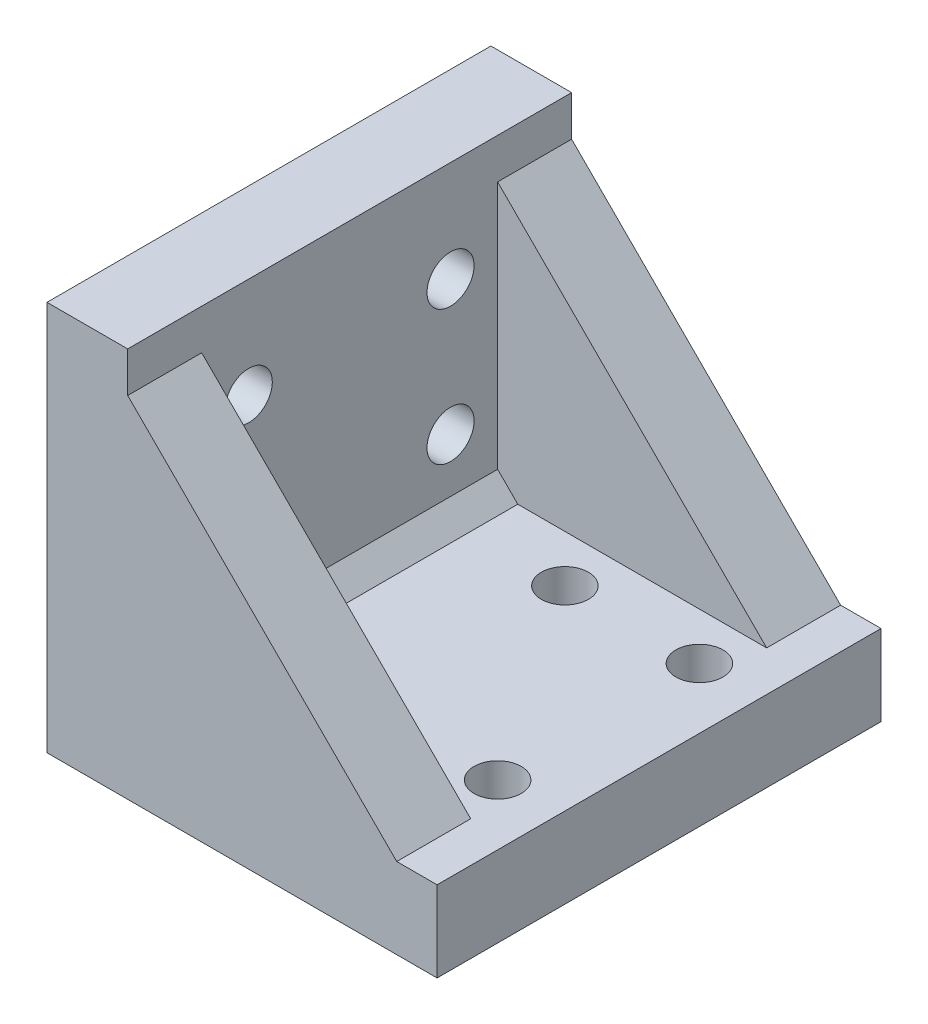
from build123d import *

# Parameters (mm, degrees)
BOSS_EXTRUDE1_DEPTH = 16.5
CUT_EXTRUDE1_REACH  = 42.525
SKETCH2_R           = 1.75
CUT_EXTRUDE2_REACH  = 42.525
SKETCH6_R           = 1.75
BOSS_EXTRUDE2_DEPTH = 5.5
CHAMFER1_SIZE       = 1.5


with BuildPart() as part:
    # Sketch1 → Boss-Extrude1 (new, symmetric)
    with BuildSketch(Plane.XY):
        Polygon((0, 0), (0, 29), (6, 29), (6, 6), (29, 6), (29, 0), align=None)
    extrude(amount=BOSS_EXTRUDE1_DEPTH, both=True)

    # Sketch2 → Cut-Extrude1 (cut, up to next)
    with BuildSketch(Plane(origin=(6, 0, 0), x_dir=(0, 0, -1), z_dir=(1, 0, 0)), mode=Mode.PRIVATE) as cut_extrude1_sk1:
        with Locations(Location((7.5, 21.5, 0), (0, 0, 90))):
            Circle(SKETCH2_R)
    cut_extrude1_tool1 = extrude(cut_extrude1_sk1.sketch, amount=-CUT_EXTRUDE1_REACH, mode=Mode.PRIVATE) & part.part
    # Sketch2 → Cut-Extrude1 (cut, up to next)
    with BuildSketch(Plane(origin=(6, 0, 0), x_dir=(0, 0, -1), z_dir=(1, 0, 0)), mode=Mode.PRIVATE) as cut_extrude1_sk2:
        with Locations(Location((7.5, 11.5, 0), (0, 0, 90))):
            Circle(SKETCH2_R)
    cut_extrude1_tool2 = extrude(cut_extrude1_sk2.sketch, amount=-CUT_EXTRUDE1_REACH, mode=Mode.PRIVATE) & part.part
    # Sketch2 → Cut-Extrude1 (cut, up to next)
    with BuildSketch(Plane(origin=(6, 0, 0), x_dir=(0, 0, -1), z_dir=(1, 0, 0)), mode=Mode.PRIVATE) as cut_extrude1_sk3:
        with Locations(Location((-7.5, 11.5, 0), (0, 0, 90))):
            Circle(SKETCH2_R)
    cut_extrude1_tool3 = extrude(cut_extrude1_sk3.sketch, amount=-CUT_EXTRUDE1_REACH, mode=Mode.PRIVATE) & part.part
    # Sketch2 → Cut-Extrude1 (cut, up to next)
    with BuildSketch(Plane(origin=(6, 0, 0), x_dir=(0, 0, -1), z_dir=(1, 0, 0)), mode=Mode.PRIVATE) as cut_extrude1_sk4:
        with Locations(Location((-7.5, 21.5, 0), (0, 0, 90))):
            Circle(SKETCH2_R)
    cut_extrude1_tool4 = extrude(cut_extrude1_sk4.sketch, amount=-CUT_EXTRUDE1_REACH, mode=Mode.PRIVATE) & part.part
    add(cut_extrude1_tool1.solids().sort_by_distance((6, 21.5, -7.5))[0], mode=Mode.SUBTRACT)
    add(cut_extrude1_tool2.solids().sort_by_distance((6, 11.5, -7.5))[0], mode=Mode.SUBTRACT)
    add(cut_extrude1_tool3.solids().sort_by_distance((6, 11.5, 7.5))[0], mode=Mode.SUBTRACT)
    add(cut_extrude1_tool4.solids().sort_by_distance((6, 21.5, 7.5))[0], mode=Mode.SUBTRACT)

    # Sketch6 → Cut-Extrude2 (cut, up to next)
    with BuildSketch(Plane(origin=(0, 6, 0), x_dir=(1, 0, 0), z_dir=(0, 1, 0)), mode=Mode.PRIVATE) as cut_extrude2_sk1:
        with Locations(Location((14.5, -7.5, 0), (0, 0, 180))):
            Circle(SKETCH6_R)
    cut_extrude2_tool1 = extrude(cut_extrude2_sk1.sketch, amount=-CUT_EXTRUDE2_REACH, mode=Mode.PRIVATE) & part.part
    # Sketch6 → Cut-Extrude2 (cut, up to next)
    with BuildSketch(Plane(origin=(0, 6, 0), x_dir=(1, 0, 0), z_dir=(0, 1, 0)), mode=Mode.PRIVATE) as cut_extrude2_sk2:
        with Locations(Location((14.5, 7.5, 0), (0, 0, 180))):
            Circle(SKETCH6_R)
    cut_extrude2_tool2 = extrude(cut_extrude2_sk2.sketch, amount=-CUT_EXTRUDE2_REACH, mode=Mode.PRIVATE) & part.part
    # Sketch6 → Cut-Extrude2 (cut, up to next)
    with BuildSketch(Plane(origin=(0, 6, 0), x_dir=(1, 0, 0), z_dir=(0, 1, 0)), mode=Mode.PRIVATE) as cut_extrude2_sk3:
        with Locations(Location((24.5, 7.5, 0), (0, 0, 180))):
            Circle(SKETCH6_R)
    cut_extrude2_tool3 = extrude(cut_extrude2_sk3.sketch, amount=-CUT_EXTRUDE2_REACH, mode=Mode.PRIVATE) & part.part
    # Sketch6 → Cut-Extrude2 (cut, up to next)
    with BuildSketch(Plane(origin=(0, 6, 0), x_dir=(1, 0, 0), z_dir=(0, 1, 0)), mode=Mode.PRIVATE) as cut_extrude2_sk4:
        with Locations(Location((24.5, -7.5, 0), (0, 0, 180))):
            Circle(SKETCH6_R)
    cut_extrude2_tool4 = extrude(cut_extrude2_sk4.sketch, amount=-CUT_EXTRUDE2_REACH, mode=Mode.PRIVATE) & part.part
    add(cut_extrude2_tool1.solids().sort_by_distance((14.5, 6, 7.5))[0], mode=Mode.SUBTRACT)
    add(cut_extrude2_tool2.solids().sort_by_distance((14.5, 6, -7.5))[0], mode=Mode.SUBTRACT)
    add(cut_extrude2_tool3.solids().sort_by_distance((24.5, 6, -7.5))[0], mode=Mode.SUBTRACT)
    add(cut_extrude2_tool4.solids().sort_by_distance((24.5, 6, 7.5))[0], mode=Mode.SUBTRACT)

    # Sketch3 → Boss-Extrude2 (add)
    with BuildSketch(Plane.XY.offset(16.5)):
        Polygon((6, 26), (26, 6), (6, 6), align=None)
    boss_extrude2 = extrude(amount=-BOSS_EXTRUDE2_DEPTH)

    # Mirror1: Boss-Extrude2 across plane
    add(boss_extrude2.mirror(Plane.XY))

    # Chamfer1
    chamfer1_edges = [part.edges().sort_by_distance(p)[0] for p in [
        (6, 6, 0),
    ]]
    chamfer(chamfer1_edges, length=CHAMFER1_SIZE)


solid = part.part
